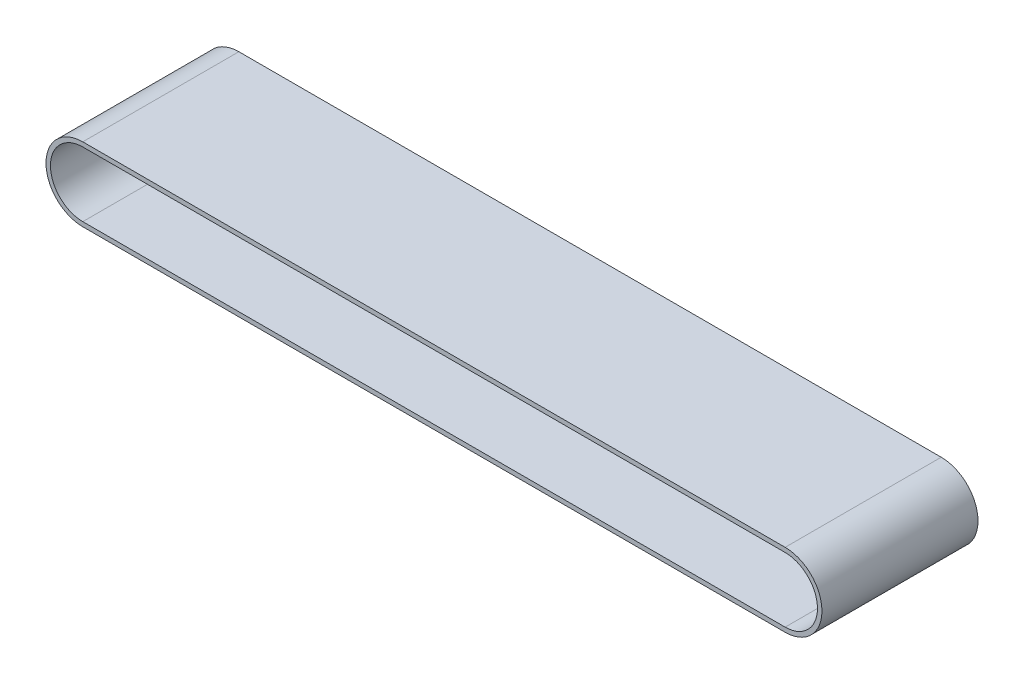
from build123d import *

# Parameters (mm, degrees)
EXTRUIR_L_MINA1_DEPTH = 35


with BuildPart() as part:
    # Croquis2 → Extruir-Lámina1 (new, symmetric)
    with BuildSketch(Plane.XY):
        with BuildLine():
            Line((315, -16.5), (0, -16.5))
            ThreePointArc((0, -16.5), (-16.5, 0), (0, 16.5))
            Line((0, 16.5), (315, 16.5))
            ThreePointArc((315, 16.5), (331.5, 0), (315, -16.5))
        make_face()
        with BuildLine():
            Line((315, -14.5), (0, -14.5))
            ThreePointArc((0, -14.5), (-14.5, 0), (0, 14.5))
            Line((0, 14.5), (315, 14.5))
            ThreePointArc((315, 14.5), (329.5, 0), (315, -14.5))
        make_face(mode=Mode.SUBTRACT)
    extrude(amount=EXTRUIR_L_MINA1_DEPTH, both=True)


solid = part.part
